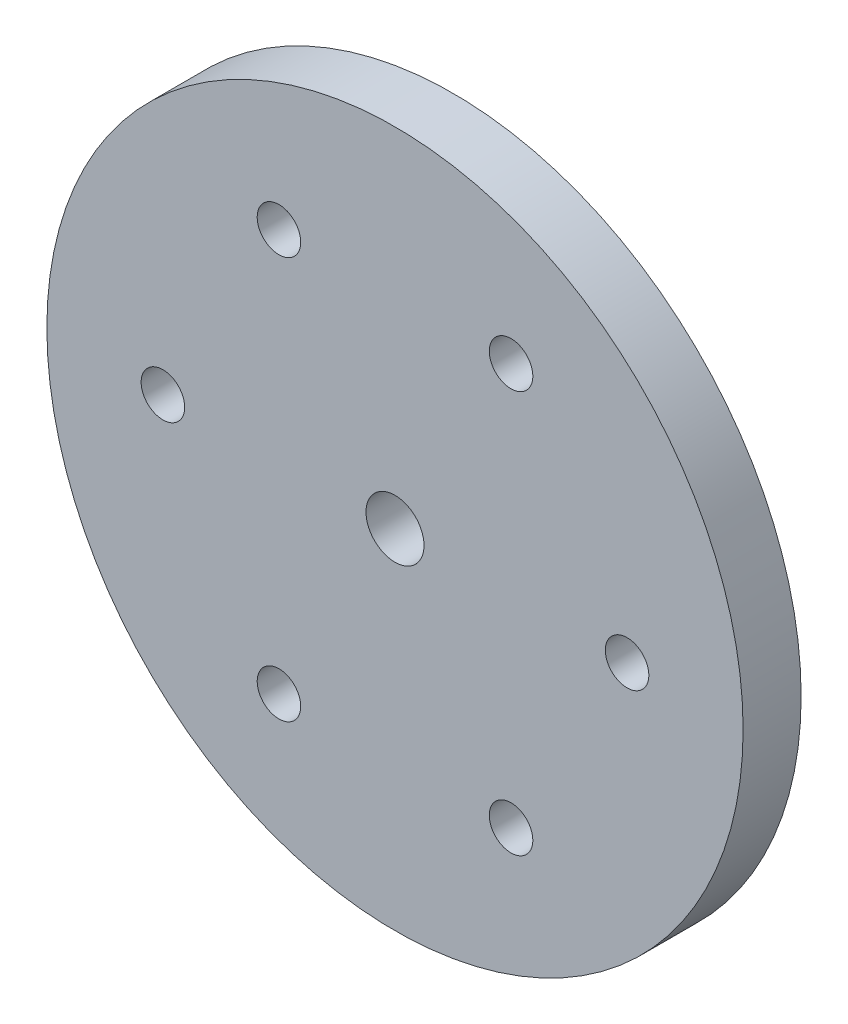
from build123d import *

# Parameters (mm, degrees)
SKETCH1_R           = 38.1
BOSS_EXTRUDE1_DEPTH = 6.35
SKETCH4_R           = 2.38125
CUT_EXTRUDE2_DEPTH  = 55.254423783
SKETCH2_R           = 3.175
CUT_EXTRUDE3_DEPTH  = 55.254423783


with BuildPart() as part:
    # Sketch1 → Boss-Extrude1 (new body)
    with BuildSketch(Plane.XY):
        Circle(SKETCH1_R)
    extrude(amount=BOSS_EXTRUDE1_DEPTH)

    # Sketch4 → Cut-Extrude2 (cut, through all)
    with BuildSketch(Plane(origin=(0, 0, 0), x_dir=(-1, 0, 0), z_dir=(0, 0, -1))):
        with Locations((-25.4, 0)):
            Circle(SKETCH4_R)
        with Locations((-12.7, 21.997045256)):
            Circle(SKETCH4_R)
        with Locations((12.7, 21.997045256)):
            Circle(SKETCH4_R)
        with Locations((25.4, 0)):
            Circle(SKETCH4_R)
        with Locations((12.7, -21.997045256)):
            Circle(SKETCH4_R)
        with Locations((-12.7, -21.997045256)):
            Circle(SKETCH4_R)
    extrude(amount=-CUT_EXTRUDE2_DEPTH, mode=Mode.SUBTRACT)

    # Sketch2 → Cut-Extrude3 (cut, through all)
    with BuildSketch(Plane.XY.offset(6.35)):
        Circle(SKETCH2_R)
    extrude(amount=-CUT_EXTRUDE3_DEPTH, mode=Mode.SUBTRACT)


solid = part.part
